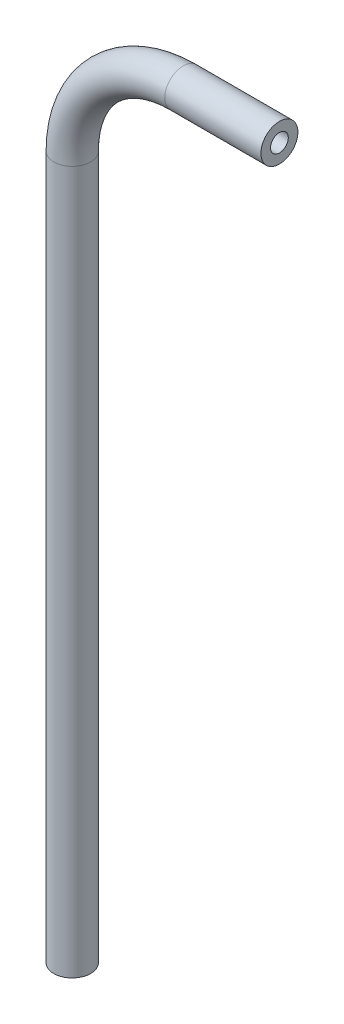
from build123d import *

# Parameters (mm, degrees)
SKETCH2_R   = 3.175
SKETCH2_R_2 = 1.524


with BuildPart() as part:
    # Sweep1: sweep along a path in Sketch1
    with BuildLine(Plane.XY) as sweep1_path:
        Line((0, -122.172317881), (0, -1.522317881))
        ThreePointArc((0, -1.522317881), (5.579615818, 11.948066301), (19.05, 17.527682119))
        Line((19.05, 17.527682119), (35.56, 17.527682119))
    # Sketch2 → Sweep1 (sweep)
    with BuildSketch(Plane(origin=(35.56, 17.527682119, 0), x_dir=(0, 0, -1), z_dir=(1, 0, 0))):
        Circle(SKETCH2_R)
        Circle(SKETCH2_R_2, mode=Mode.SUBTRACT)
    sweep(path=sweep1_path.line)


solid = part.part
